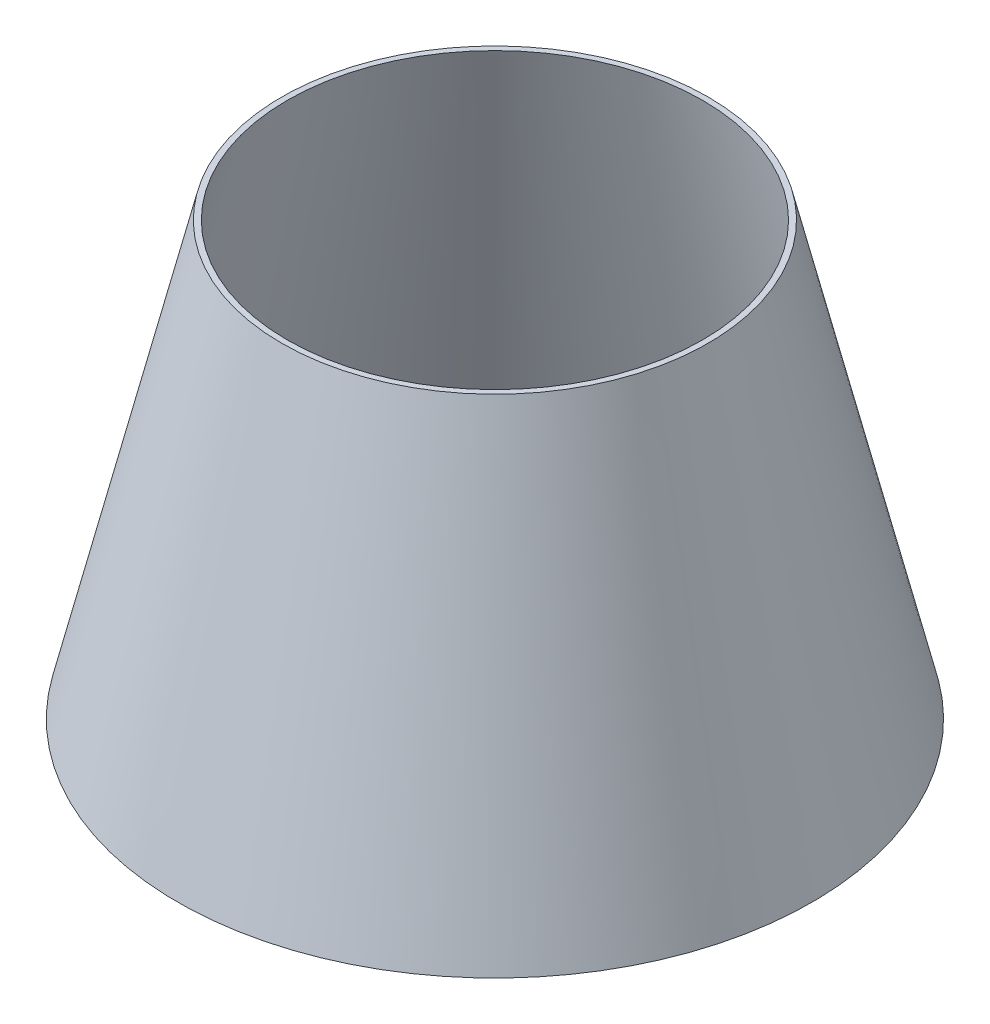
from build123d import *

# Parameters (mm, degrees)
CUT_EXTRUDE2_DEPTH      = 1
CUT_EXTRUDE2_DEPTH_BACK = 1
SKETCH3_R               = 60.220882867


with BuildPart() as part:
    # Sketch1 → Revolve2 (revolve)
    with BuildSketch(Plane.XY):
        Polygon((293.241827877, 285.313893784), (294.18225546, 285.066231552), (312.952510051, 363.087013323), (311.949293455, 363.087013323), align=None)
    revolve(axis=Axis((349.842227762, 375.065911477, 0), (0, -1, 0)))

    # Sketch3 → Cut-Extrude2 (cut, two sides: drawn at the far end of the back side and taken through both)
    with BuildSketch(Plane(origin=(0, 285.313893784, 0), x_dir=(-1, 0, 0), z_dir=(0, -1, 0)).offset(-CUT_EXTRUDE2_DEPTH_BACK)):
        with Locations((-349.842227762, 0)):
            Circle(SKETCH3_R)
    extrude(amount=CUT_EXTRUDE2_DEPTH + CUT_EXTRUDE2_DEPTH_BACK, mode=Mode.SUBTRACT)


solid = part.part
